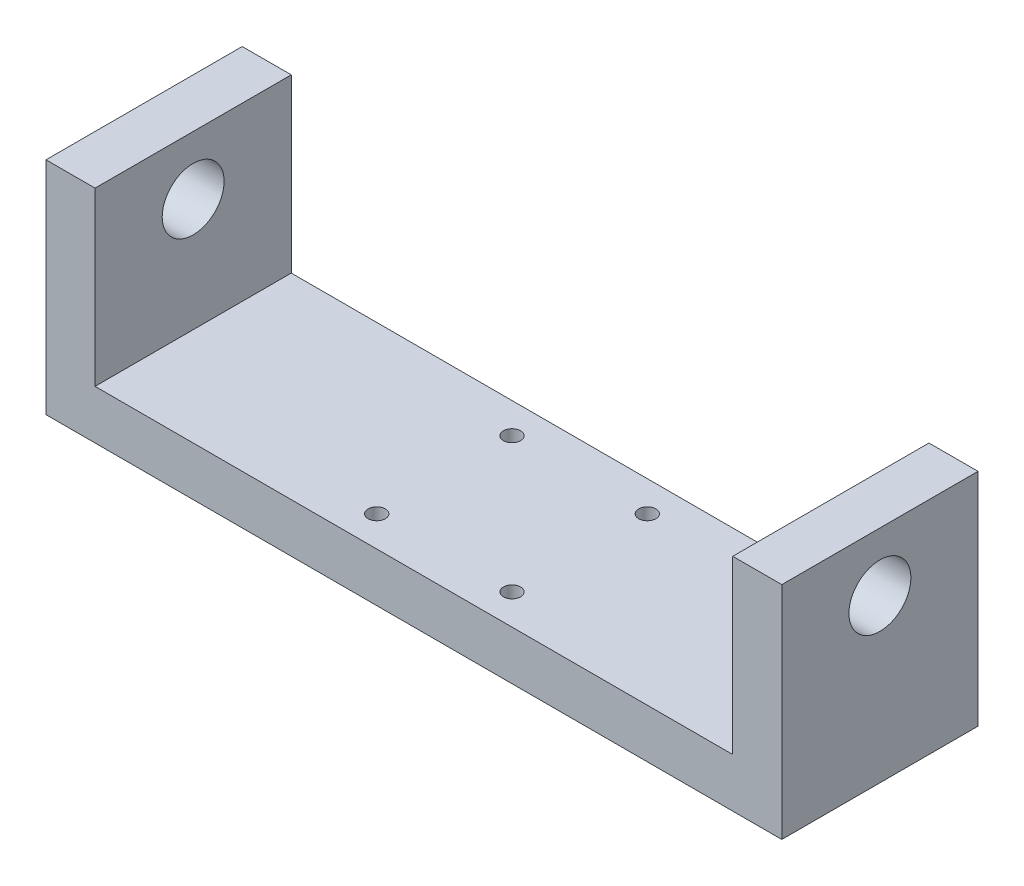
from build123d import *

# Parameters (mm, degrees)
BOSS_EXTRU_1_DEPTH      = 40
ESQUISSE2_R             = 1.75
ENL_V_MAT_EXTRU_1_DEPTH = 92.923881554
ESQUISSE5_R             = 6.3126
ENL_V_MAT_EXTRU_2_DEPTH = 162.632298752


with BuildPart() as part:
    # Esquisse1 → Boss.-Extru.1 (new body)
    with BuildSketch(Plane.XY):
        Polygon((-65, 45), (-75, 45), (-75, 0), (75, 0), (75, 45), (65, 45), (65, 10), (-65, 10), align=None)
    extrude(amount=BOSS_EXTRU_1_DEPTH)

    # Esquisse2 → Enlèv. mat.-Extru.1 (cut, through all)
    with BuildSketch(Plane(origin=(0, 10, 0), x_dir=(1, 0, 0), z_dir=(0, 1, 0))):
        with Locations(Location((-13.788582233, -6.211417767, 0), (0, 0, 270))):
            Circle(ESQUISSE2_R)
        with Locations(Location((13.788582233, -6.211417767, 0), (0, 0, 270))):
            Circle(ESQUISSE2_R)
        with Locations(Location((13.788582233, -33.788582233, 0), (0, 0, 270))):
            Circle(ESQUISSE2_R)
        with Locations(Location((-13.788582233, -33.788582233, 0), (0, 0, 270))):
            Circle(ESQUISSE2_R)
    extrude(amount=-ENL_V_MAT_EXTRU_1_DEPTH, mode=Mode.SUBTRACT)

    # Esquisse5 → Enlèv. mat.-Extru.2 (cut, through all)
    with BuildSketch(Plane.ZY.offset(75)):
        with Locations((20, 33.0538058)):
            Circle(ESQUISSE5_R)
    extrude(amount=-ENL_V_MAT_EXTRU_2_DEPTH, mode=Mode.SUBTRACT)


solid = part.part
